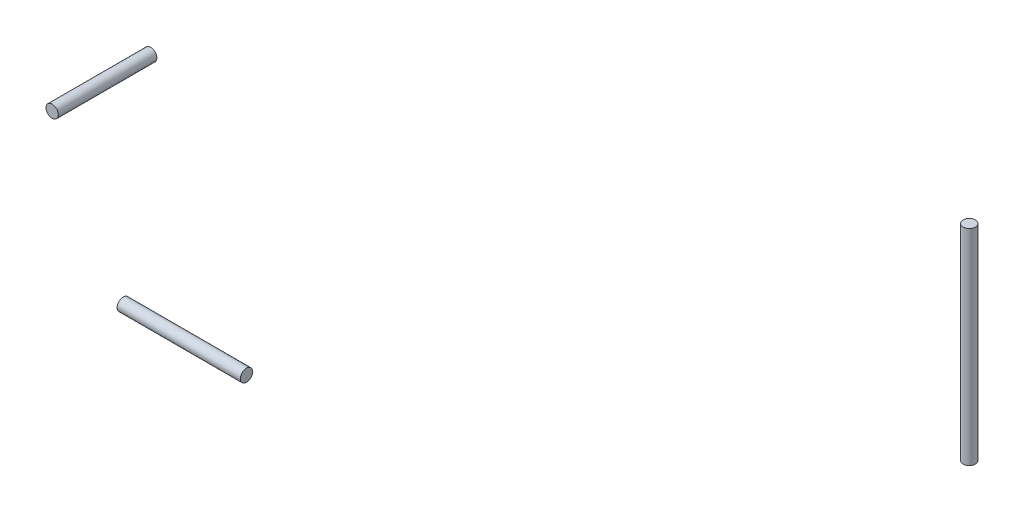
from build123d import *

# Parameters (mm, degrees)
TC1_SPRING_START    = 38
SKETCH1_R           = 0.75
TC1_SPRING_DEPTH    = 12
TC2_AIR_START       = 190
SKETCH2_R           = 0.75
TC2_AIR_DEPTH       = 25
TC3_REFLECTOR_START = 89
SKETCH3_R           = 0.75
TC3_REFLECTOR_DEPTH = 15


with BuildPart() as part:
    # Sketch1 → tc1_spring (new body)
    with BuildSketch(Plane.XY.offset(TC1_SPRING_START)):
        with Locations((66.34, 221)):
            Circle(SKETCH1_R)
    extrude(amount=TC1_SPRING_DEPTH)


with BuildPart() as body_2:
    # Sketch2 → tc2_air (new body)
    with BuildSketch(Plane(origin=(0, 0, 0), x_dir=(1, 0, 0), z_dir=(0, 1, 0)).offset(TC2_AIR_START)):
        with Locations(Location((128, 0, 0), (0, 0, 270))):
            Circle(SKETCH2_R)
    extrude(amount=TC2_AIR_DEPTH)


with BuildPart() as body_3:
    # Sketch3 → tc3_reflector (new body)
    with BuildSketch(Plane(origin=(0, 0, 0), x_dir=(0, 0, -1), z_dir=(1, 0, 0)).offset(TC3_REFLECTOR_START)):
        with Locations((-64, 219)):
            Circle(SKETCH3_R)
    extrude(amount=TC3_REFLECTOR_DEPTH)


solid = Compound([part.part, body_2.part, body_3.part])
